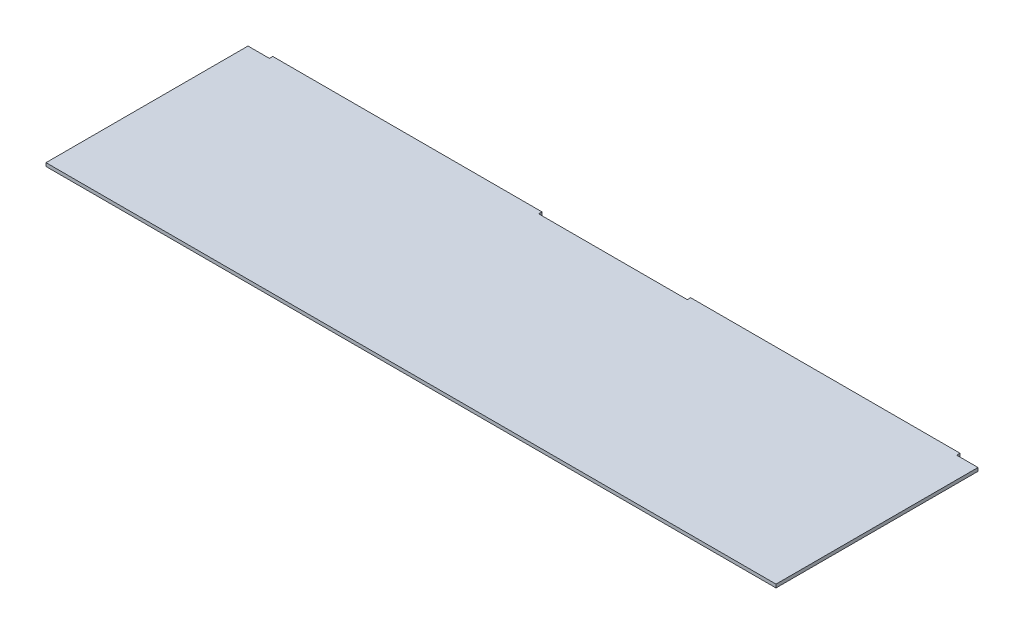
from build123d import *

# Parameters (mm, degrees)
SKETCH1_W           = 688.4416
SKETCH1_H           = 190.5
BOSS_EXTRUDE1_DEPTH = 1.5875
SKETCH2_W           = 254
SKETCH2_H           = 3.175
BOSS_EXTRUDE2_DEPTH = 3.175


with BuildPart() as part:
    # Sketch1 → Boss-Extrude1 (new, symmetric)
    with BuildSketch(Plane(origin=(0, 0, 0), x_dir=(1, 0, 0), z_dir=(0, 1, 0))):
        Rectangle(SKETCH1_W, SKETCH1_H)
    extrude(amount=BOSS_EXTRUDE1_DEPTH, both=True)

    # Sketch2 → Boss-Extrude2 (add)
    with BuildSketch(Plane(origin=(0, 0, -95.25), x_dir=(-1, 0, 0), z_dir=(0, 0, -1))):
        with Locations((-197.0659, 0)):
            Rectangle(SKETCH2_W, SKETCH2_H)
        with Locations((197.0659, 0)):
            Rectangle(SKETCH2_W, SKETCH2_H)
    extrude(amount=BOSS_EXTRUDE2_DEPTH)


solid = part.part
